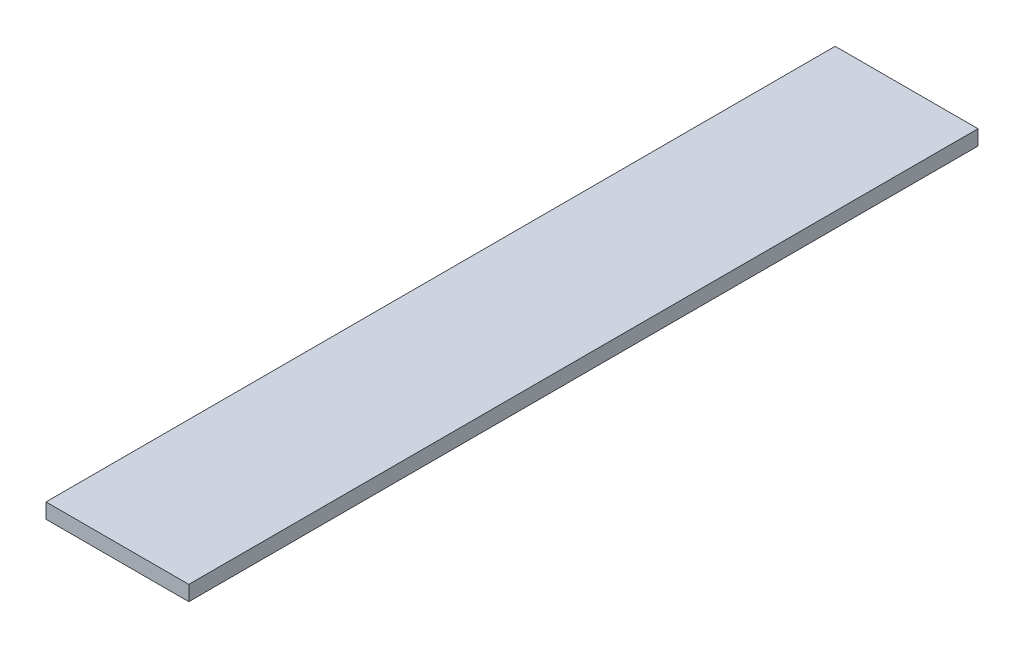
from build123d import *

# Parameters (mm, degrees)
SKETCH2_W           = 24.13
SKETCH2_H           = 2.54
BOSS_EXTRUDE1_DEPTH = 133.35


with BuildPart() as part:
    # Sketch2 → Boss-Extrude1 (new body)
    with BuildSketch(Plane.XY):
        with Locations((-14.76375, 12.779375)):
            Rectangle(SKETCH2_W, SKETCH2_H)
    extrude(amount=BOSS_EXTRUDE1_DEPTH)


solid = part.part
